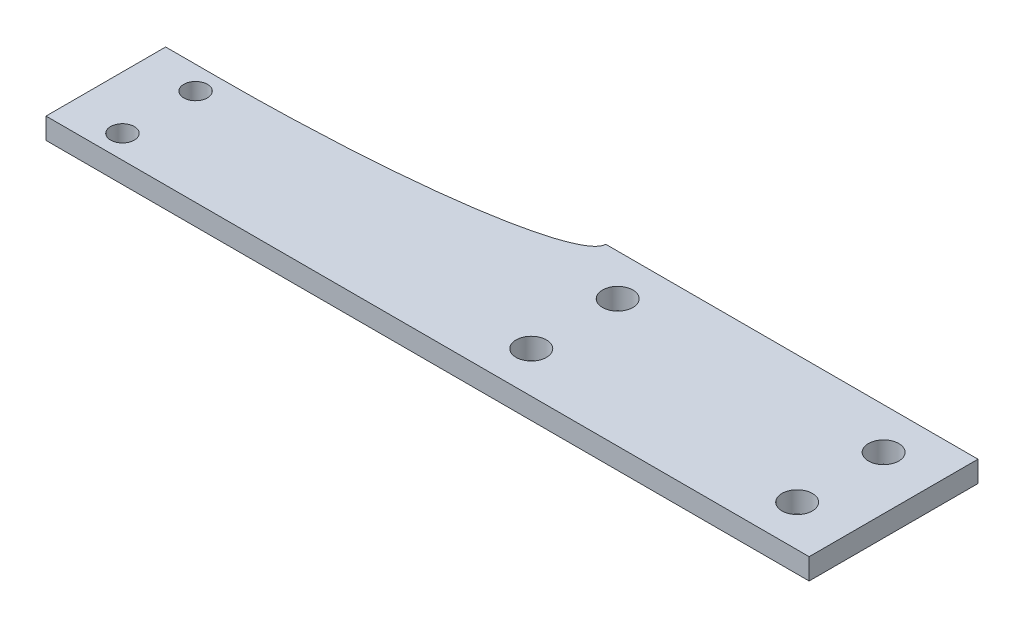
from build123d import *

# Parameters (mm, degrees)
SKETCH1_R           = 0.89
SKETCH1_R_2         = 1.143
BOSS_EXTRUDE1_DEPTH = 1.5875


with BuildPart() as part:
    # Sketch1 → Boss-Extrude1 (new body)
    with BuildSketch(Plane(origin=(0, 0, 0), x_dir=(1, 0, 0), z_dir=(0, 1, 0))):
        with BuildLine():
            Line((-26.7, -6.35), (26.7, -6.35))
            Line((26.7, -6.35), (26.7, 6.35))
            Line((26.7, 6.35), (-1.3, 6.35))
            add(Edge.make_bspline(
                [(-26.7, 2.65), (-1.3, 2.65), (-1.3, 6.35)],
                knots=[4.71238898, 4.71238898, 4.71238898, 6.283185307, 6.283185307, 6.283185307], degree=2, weights=[1, 0.707106781, 1]))
            Line((-26.7, 2.65), (-30.7, 2.65))
            Line((-30.7, 2.65), (-30.7, -6.35))
            Line((-30.7, -6.35), (-26.7, -6.35))
        make_face()
        with Locations(Location((-26.7, 0.9, 0), (0, 0, 270))):
            Circle(SKETCH1_R, mode=Mode.SUBTRACT)
        with Locations(Location((-26.7, -4.6, 0), (0, 0, 270))):
            Circle(SKETCH1_R, mode=Mode.SUBTRACT)
        with Locations(Location((2.7, 3.25, 0), (0, 0, 270))):
            Circle(SKETCH1_R_2, mode=Mode.SUBTRACT)
        with Locations(Location((2.7, -3.25, 0), (0, 0, 270))):
            Circle(SKETCH1_R_2, mode=Mode.SUBTRACT)
        with Locations(Location((22.7, 3.25, 0), (0, 0, 270))):
            Circle(SKETCH1_R_2, mode=Mode.SUBTRACT)
        with Locations(Location((22.7, -3.25, 0), (0, 0, 270))):
            Circle(SKETCH1_R_2, mode=Mode.SUBTRACT)
    extrude(amount=BOSS_EXTRUDE1_DEPTH)


solid = part.part
